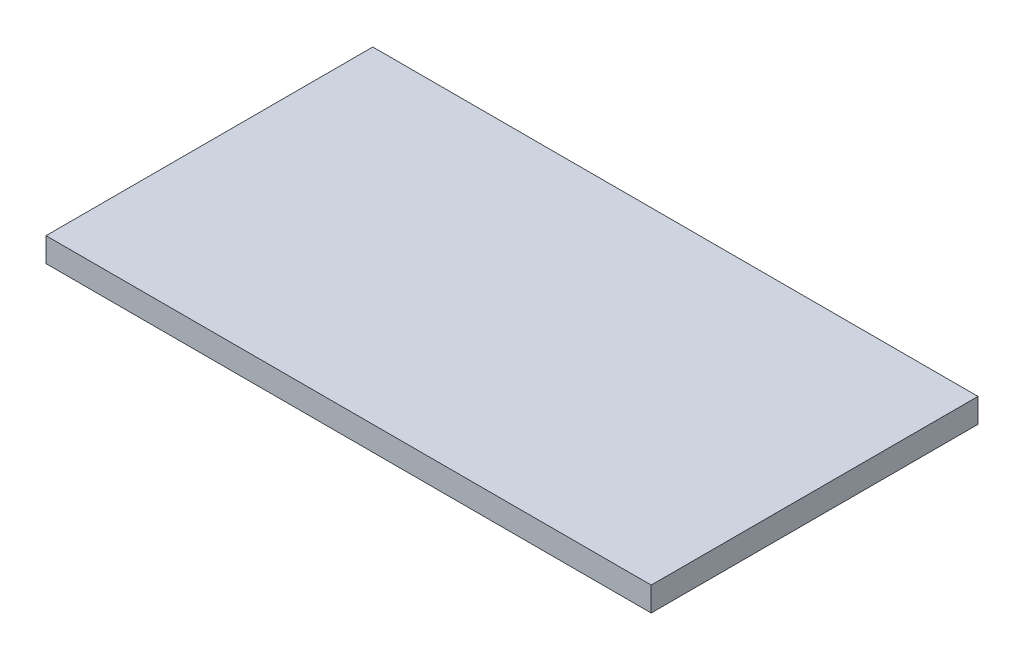
from build123d import *

# Parameters (mm, degrees)
SKETCH1_W           = 50
SKETCH1_H           = 27
BOSS_EXTRUDE1_DEPTH = 2


with BuildPart() as part:
    # Sketch1 → Boss-Extrude1 (new body)
    with BuildSketch(Plane(origin=(0, 0, 0), x_dir=(1, 0, 0), z_dir=(0, 1, 0))):
        Rectangle(SKETCH1_W, SKETCH1_H)
    extrude(amount=BOSS_EXTRUDE1_DEPTH)


solid = part.part
